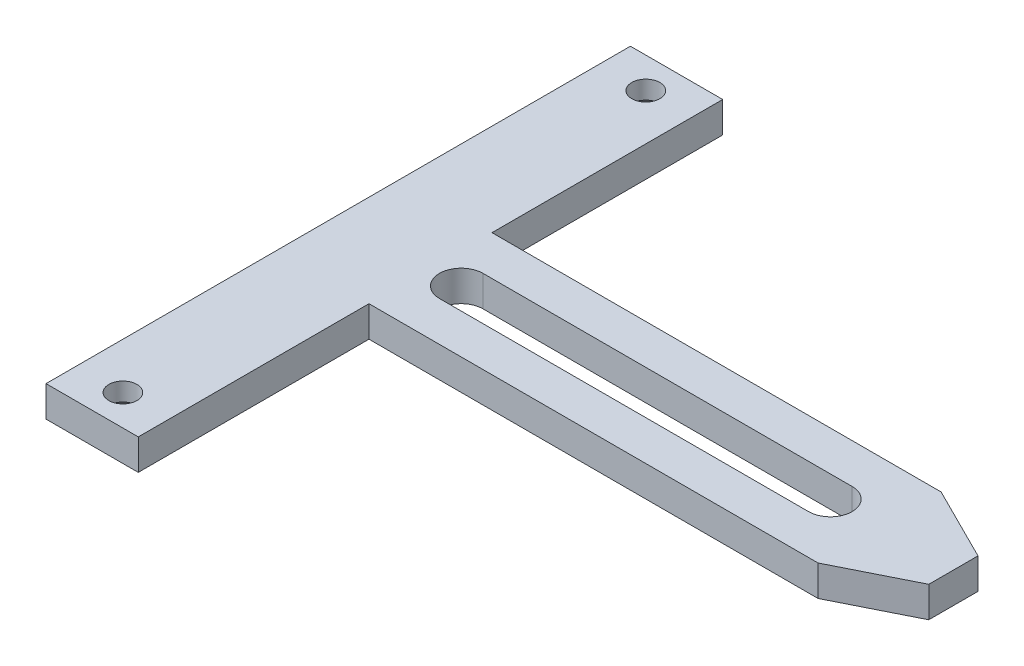
from build123d import *

# Parameters (mm, degrees)
SKETCH2_W                                         = 63.5
SKETCH2_H                                         = 60.325
BOSS_EXTRUDE1_DEPTH                               = 1.5875
CUT_EXTRUDE1_REACH                                = 45.908
CUT_EXTRUDE2_REACH                                = 45.908
CSK_FOR_M2_5_FLAT_HEAD_MACHINE_SCREW1_D           = 2.9
CSK_FOR_M2_5_FLAT_HEAD_MACHINE_SCREW1_CSINK_D     = 5.5
CSK_FOR_M2_5_FLAT_HEAD_MACHINE_SCREW1_CSINK_ANGLE = 90


with BuildPart() as part:
    # Sketch2 → Boss-Extrude1 (new, symmetric)
    with BuildSketch(Plane(origin=(0, 0, 0), x_dir=(1, 0, 0), z_dir=(0, 1, 0))):
        Rectangle(SKETCH2_W, SKETCH2_H)
    extrude(amount=BOSS_EXTRUDE1_DEPTH, both=True)

    # Sketch4 → Cut-Extrude1 (cut, up to next)
    with BuildSketch(Plane(origin=(0, 1.5875, 0), x_dir=(1, 0, 0), z_dir=(0, 1, 0)), mode=Mode.PRIVATE) as cut_extrude1_sk1:
        Polygon((-22.225, -30.1625), (31.75, -30.1625), (31.75, -2.54), (24.13, -6.35), (-22.225, -6.35), align=None)
    cut_extrude1_tool1 = extrude(cut_extrude1_sk1.sketch, amount=-CUT_EXTRUDE1_REACH, mode=Mode.PRIVATE) & part.part
    # Sketch4 → Cut-Extrude1 (cut, up to next)
    with BuildSketch(Plane(origin=(0, 1.5875, 0), x_dir=(1, 0, 0), z_dir=(0, 1, 0)), mode=Mode.PRIVATE) as cut_extrude1_sk2:
        Polygon((31.75, 2.54), (24.13, 6.35), (-22.225, 6.35), (-22.225, 30.1625), (31.75, 30.1625), align=None)
    cut_extrude1_tool2 = extrude(cut_extrude1_sk2.sketch, amount=-CUT_EXTRUDE1_REACH, mode=Mode.PRIVATE) & part.part
    add(cut_extrude1_tool1.solids().sort_by_distance((5.035529, 1.5875, 18.109098))[0], mode=Mode.SUBTRACT)
    add(cut_extrude1_tool2.solids().sort_by_distance((5.035529, 1.5875, -18.109098))[0], mode=Mode.SUBTRACT)

    # Sketch5 → Cut-Extrude2 (cut, up to next)
    with BuildSketch(Plane(origin=(0, 1.5875, 0), x_dir=(1, 0, 0), z_dir=(0, 1, 0)), mode=Mode.PRIVATE) as cut_extrude2_sk1:
        with BuildLine():
            Line((-19.05, 2.2479), (19.05, 2.2479))
            ThreePointArc((19.05, 2.2479), (21.2979, 0), (19.05, -2.2479))
            Line((19.05, -2.2479), (-19.05, -2.2479))
            ThreePointArc((-19.05, -2.2479), (-21.2979, 0), (-19.05, 2.2479))
        make_face()
    cut_extrude2_tool1 = extrude(cut_extrude2_sk1.sketch, amount=-CUT_EXTRUDE2_REACH, mode=Mode.PRIVATE) & part.part
    add(cut_extrude2_tool1.solids().sort_by_distance((0, 1.5875, 0))[0], mode=Mode.SUBTRACT)

    # CSK for M2.5 Flat Head Machine Screw1 (through all)
    with Locations(Plane.XZ.offset(1.5875)):
        with Locations((-26.9875, 26.9875)):
            csk_for_m2_5_flat_head_machine_screw1 = CounterSinkHole(CSK_FOR_M2_5_FLAT_HEAD_MACHINE_SCREW1_D / 2, CSK_FOR_M2_5_FLAT_HEAD_MACHINE_SCREW1_CSINK_D / 2, counter_sink_angle=CSK_FOR_M2_5_FLAT_HEAD_MACHINE_SCREW1_CSINK_ANGLE)

    # Mirror1: CSK for M2.5 Flat Head Machine Screw1 across plane
    add(csk_for_m2_5_flat_head_machine_screw1.mirror(Plane.XY), mode=Mode.SUBTRACT)


solid = part.part
